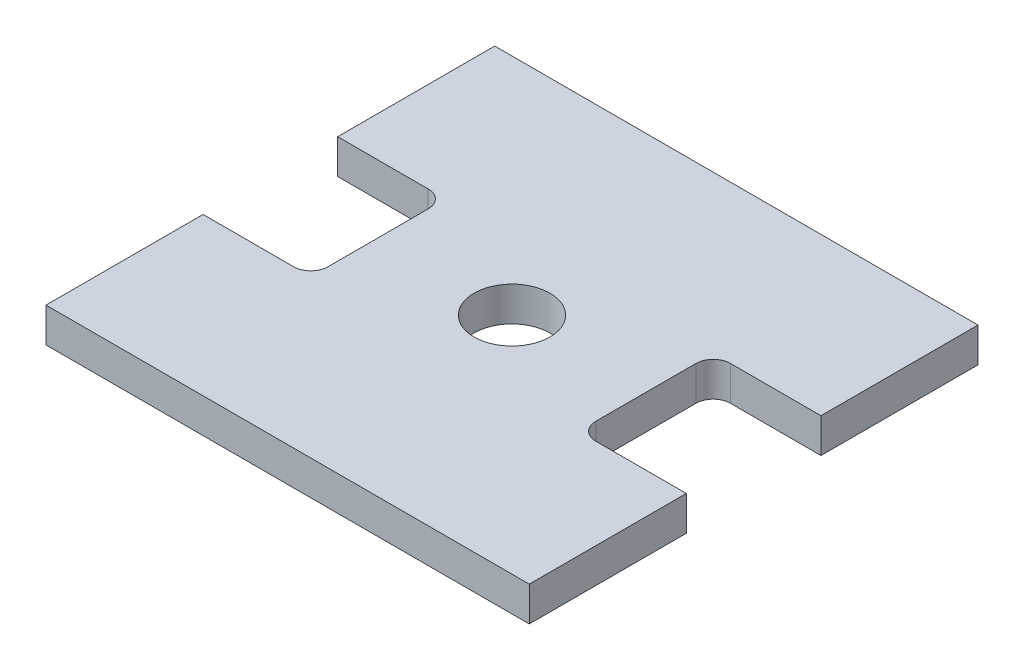
from build123d import *

# Parameters (mm, degrees)
SKETCH_1_R      = 11
EXTRUDE_1_DEPTH = 10


with BuildPart() as part:
    # Эскиз1 → Вытянуть1 (new body)
    with BuildSketch(Plane(origin=(0, 0, 0), x_dir=(1, 0, 0), z_dir=(0, 1, 0))):
        with BuildLine():
            Line((-34.176272466, 48.057375978), (105.823727534, 48.057375978))
            Line((105.823727534, 48.057375978), (105.823727534, 2.562145774))
            Line((105.823727534, 2.562145774), (79.601322316, 2.562145774))
            ThreePointArc((79.601322316, 2.562145774), (76.06578841, 1.09767968), (74.601322316, -2.437854226))
            Line((74.601322316, -2.437854226), (74.601322316, -31.447393818))
            ThreePointArc((74.601322316, -31.447393818), (76.06578841, -34.982927724), (79.601322316, -36.447393818))
            Line((79.601322316, -36.447393818), (105.823727534, -36.447393818))
            Line((105.823727534, -36.447393818), (105.823727534, -81.942624022))
            Line((105.823727534, -81.942624022), (-34.176272466, -81.942624022))
            Line((-34.176272466, -81.942624022), (-34.176272466, -36.447393818))
            Line((-34.176272466, -36.447393818), (-7.953867248, -36.447393818))
            ThreePointArc((-7.953867248, -36.447393818), (-4.418333342, -34.982927724), (-2.953867248, -31.447393818))
            Line((-2.953867248, -31.447393818), (-2.953867248, -2.437854226))
            ThreePointArc((-2.953867248, -2.437854226), (-4.418333342, 1.09767968), (-7.953867248, 2.562145774))
            Line((-7.953867248, 2.562145774), (-34.176272466, 2.562145774))
            Line((-34.176272466, 2.562145774), (-34.176272466, 48.057375978))
        make_face()
        with Locations(Location((35.823727534, -16.942624022, 0), (0, 0, 270))):
            Circle(SKETCH_1_R, mode=Mode.SUBTRACT)
    extrude(amount=EXTRUDE_1_DEPTH)


solid = part.part
